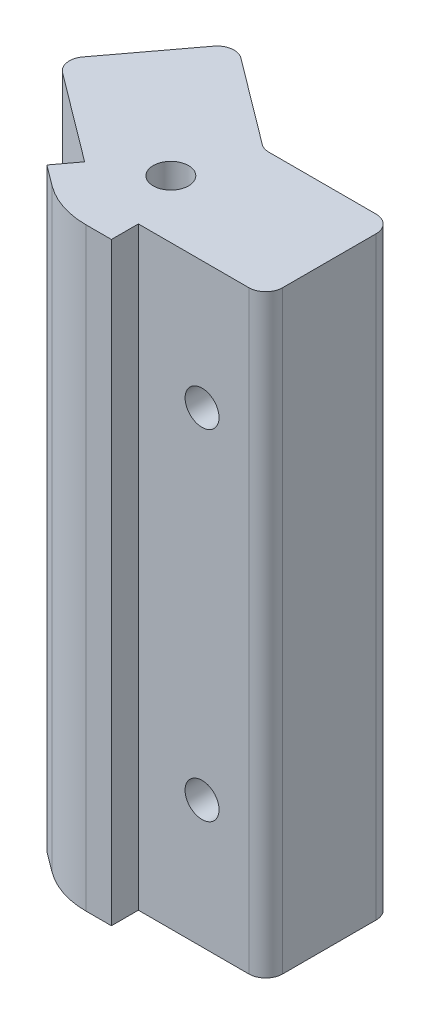
from build123d import *

# Parameters (mm, degrees)
SKETCH1_R           = 2.0788
BOSS_EXTRUDE1_DEPTH = 70
SKETCH2_R           = 2
CUT_EXTRUDE1_DEPTH  = 15
SKETCH3_R           = 2
CUT_EXTRUDE2_DEPTH  = 15
CUT_EXTRUDE3_DEPTH  = 5
CUT_EXTRUDE4_DEPTH  = 5
CUT_EXTRUDE5_START  = -5
CUT_EXTRUDE5_DEPTH  = 5
FILLET1_R           = 2


with BuildPart() as part:
    # Sketch1 → Boss-Extrude1 (new body)
    with BuildSketch(Plane(origin=(0, 0, 0), x_dir=(1, 0, 0), z_dir=(0, 1, 0))):
        with BuildLine():
            Line((-18.495, 5.34), (-9.495, 17.34))
            Line((-9.495, 17.34), (2.725, 8.175))
            Line((2.725, 8.175), (18, 8.175))
            Line((18, 8.175), (18, -6.825))
            Line((18, -6.825), (3, -6.825))
            Line((3, -6.825), (3, -10))
            Line((3, -10), (0, -10))
            ThreePointArc((0, -10), (-3.16227766, -9.486832981), (-6, -8))
            Line((-6, -8), (-8.4, -6.2))
            Line((-8.4, -6.2), (-6.495, -3.66))
            Line((-6.495, -3.66), (-18.495, 5.34))
        make_face()
        with Locations(Location((0, 0, 0), (0, 0, 270))):
            Circle(SKETCH1_R, mode=Mode.SUBTRACT)
    extrude(amount=BOSS_EXTRUDE1_DEPTH)

    # Sketch2 → Cut-Extrude1 (cut)
    with BuildSketch(Plane.XY.offset(6.825)):
        with Locations((10.5, 15)):
            Circle(SKETCH2_R)
        with Locations((10.5, 55)):
            Circle(SKETCH2_R)
    extrude(amount=-CUT_EXTRUDE1_DEPTH, mode=Mode.SUBTRACT)

    # Sketch3 → Cut-Extrude2 (cut)
    with BuildSketch(Plane(origin=(-4.095, 0, 5.46), x_dir=(0.8000000000000002, 0, 0.5999999999999999), z_dir=(-0.5999999999999999, 0, 0.8000000000000003))):
        with Locations((-10.5, 15)):
            Circle(SKETCH3_R)
        with Locations((-10.5, 55)):
            Circle(SKETCH3_R)
    extrude(amount=-CUT_EXTRUDE2_DEPTH, mode=Mode.SUBTRACT)

    # Sketch4 → Cut-Extrude3 (cut)
    with BuildSketch(Plane(origin=(4.905, 0, -6.54), x_dir=(-0.8000000000000002, 0, -0.5999999999999998), z_dir=(0.5999999999999998, 0, -0.8000000000000002))):
        Polygon((10.5, 59.871392896), (6.28125, 57.435696448), (6.28125, 52.564303552), (10.5, 50.128607104), (14.71875, 52.564303552), (14.71875, 57.435696448), align=None)
        Polygon((10.5, 10.128607104), (14.71875, 12.564303552), (14.71875, 17.435696448), (10.5, 19.871392896), (6.28125, 17.435696448), (6.28125, 12.564303552), align=None)
    extrude(amount=-CUT_EXTRUDE3_DEPTH, mode=Mode.SUBTRACT)

    # Sketch5 → Cut-Extrude4 (cut)
    with BuildSketch(Plane(origin=(0, 0, -8.175), x_dir=(-1, 0, 0), z_dir=(0, 0, -1))):
        Polygon((-10.5, 50.128607104), (-6.28125, 52.564303552), (-6.28125, 57.435696448), (-10.5, 59.871392896), (-14.71875, 57.435696448), (-14.71875, 52.564303552), align=None)
        Polygon((-10.5, 10.128607104), (-6.28125, 12.564303552), (-6.28125, 17.435696448), (-10.5, 19.871392896), (-14.71875, 17.435696448), (-14.71875, 12.564303552), align=None)
    extrude(amount=-CUT_EXTRUDE4_DEPTH, mode=Mode.SUBTRACT)

    # Sketch7 → Cut-Extrude5 (cut)
    with BuildSketch(Plane(origin=(0, 70, 0), x_dir=(1, 0, 0), z_dir=(0, 1, 0)).offset(CUT_EXTRUDE5_START)):
        Polygon((-4.773906582, -0.97690802), (-0.83361646, 10.843962345), (2.725, 8.175), (7.173270575, 8.175), (3.232980454, -3.645870365), (-1.540926128, -4.622778385), align=None)
    extrude(amount=-CUT_EXTRUDE5_DEPTH, mode=Mode.SUBTRACT)

    # Fillet1
    fillet1_edges = [part.edges().sort_by_distance(p)[0] for p in [
        (2.725, 30, -8.175),
        (-18.495, 35, -5.34),
        (-9.495, 35, -17.34),
        (2.725, 67.5, -8.175),
        (18, 35, -8.175),
        (18, 35, 6.825),
    ]]
    fillet(fillet1_edges, radius=FILLET1_R)


solid = part.part
